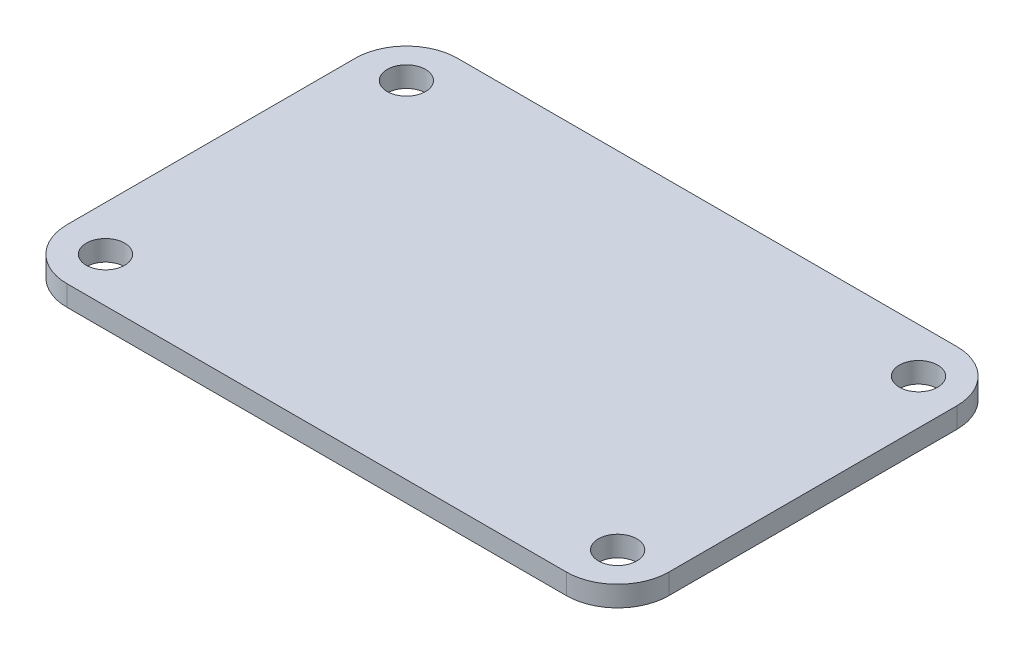
from build123d import *

# Parameters (mm, degrees)
SKETCH_1_R      = 1.5
EXTRUDE_1_DEPTH = 1.6


with BuildPart() as part:
    # 草图1 → 凸台-拉伸1 (new body)
    with BuildSketch(Plane(origin=(0, 0, 0), x_dir=(1, 0, 0), z_dir=(0, 1, 0))):
        with BuildLine():
            Line((-16.000639258, 16.174929686), (22.999360742, 16.174929686))
            ThreePointArc((22.999360742, 16.174929686), (25.827787867, 15.003356811), (26.999360742, 12.174929686))
            Line((26.999360742, 12.174929686), (26.999360742, -10.325070314))
            ThreePointArc((26.999360742, -10.325070314), (25.827787867, -13.153497439), (22.999360742, -14.325070314))
            Line((22.999360742, -14.325070314), (-16.000639258, -14.325070314))
            ThreePointArc((-16.000639258, -14.325070314), (-18.829066382, -13.153497439), (-20.000639258, -10.325070314))
            Line((-20.000639258, -10.325070314), (-20.000639258, 12.174929686))
            ThreePointArc((-20.000639258, 12.174929686), (-18.829066382, 15.003356811), (-16.000639258, 16.174929686))
        make_face()
        with Locations(Location((-16.500639258, 12.674929686, 0), (0, 0, 270))):
            Circle(SKETCH_1_R, mode=Mode.SUBTRACT)
        with Locations(Location((23.499360742, 12.674929686, 0), (0, 0, 270))):
            Circle(SKETCH_1_R, mode=Mode.SUBTRACT)
        with Locations(Location((-16.500639258, -10.825070314, 0), (0, 0, 270))):
            Circle(SKETCH_1_R, mode=Mode.SUBTRACT)
        with Locations(Location((23.499360742, -10.825070314, 0), (0, 0, 270))):
            Circle(SKETCH_1_R, mode=Mode.SUBTRACT)
    extrude(amount=EXTRUDE_1_DEPTH)


solid = part.part
